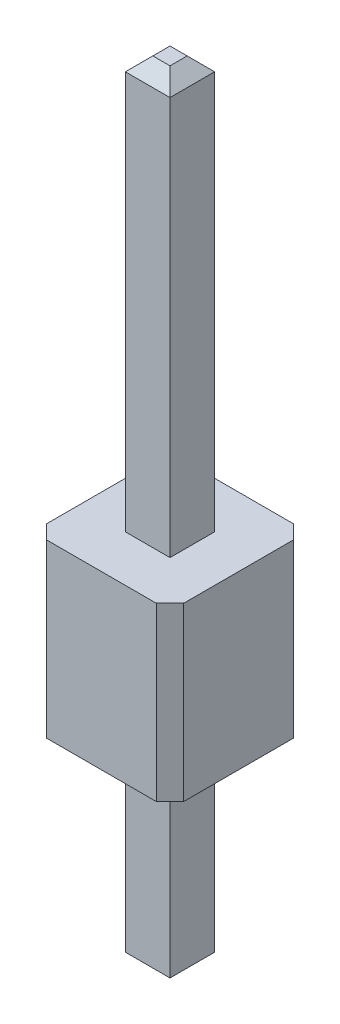
from build123d import *

# Parameters (mm, degrees)
SKETCH1_W                = 2
SKETCH1_H                = 2
BOSS_EXTRUDE1_DEPTH      = 2.5
BOSS_EXTRUDE2_DEPTH      = 6
BOSS_EXTRUDE2_DEPTH_BACK = 5.5
SKETCH2_W                = 0.65
SKETCH2_H                = 0.65
CHAMFER1_SIZE            = 0.2
CHAMFER2_SIZE            = 0.2


with BuildPart() as part:
    # Sketch1 → Boss-Extrude1 (new body)
    with BuildSketch(Plane(origin=(0, 0, 0), x_dir=(1, 0, 0), z_dir=(0, 1, 0))):
        Rectangle(SKETCH1_W, SKETCH1_H)
    extrude(amount=BOSS_EXTRUDE1_DEPTH)

    # Sketch2 → Boss-Extrude2 (add, two sides: drawn at the far end of the back side and taken through both)
    with BuildSketch(Plane(origin=(0, 2.5, 0), x_dir=(1, 0, 0), z_dir=(0, 1, 0)).offset(-BOSS_EXTRUDE2_DEPTH_BACK)):
        Rectangle(SKETCH2_W, SKETCH2_H)
    extrude(amount=BOSS_EXTRUDE2_DEPTH + BOSS_EXTRUDE2_DEPTH_BACK)

    # Chamfer1
    chamfer1_edges = [part.edges().sort_by_distance(p)[0] for p in [
        (1, 1.25, 1),
        (-1, 1.25, 1),
        (-1, 1.25, -1),
        (1, 1.25, -1),
    ]]
    chamfer(chamfer1_edges, length=CHAMFER1_SIZE)

    # Chamfer2
    chamfer2_edges = [part.edges().sort_by_distance(p)[0] for p in [
        (0.325, -3, 0),
        (0, -3, 0.325),
        (-0.325, -3, 0),
        (0, -3, -0.325),
        (0.325, 8.5, 0),
        (0, 8.5, -0.325),
        (-0.325, 8.5, 0),
        (0, 8.5, 0.325),
    ]]
    chamfer(chamfer2_edges, length=CHAMFER2_SIZE)


solid = part.part
